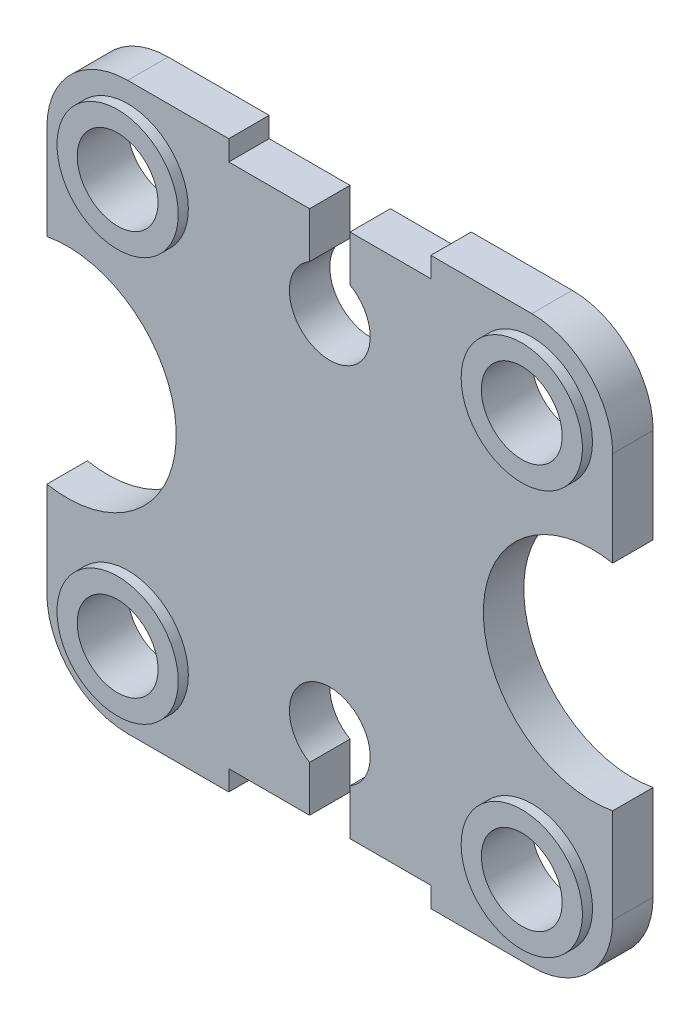
from build123d import *
from build123d.topology import SkipClean

# Parameters (mm, degrees)
SKETCH1_R                                    = 30
BOSS_EXTRUDE3_DEPTH                          = 20
SKETCH1_3_R                                  = 30
SKETCH1_3_R_2                                = 20
BOSS_EXTRUDE4_DEPTH                          = 25
MIRROR1_AT_THE_SECOND_PLANE_COPY_1_SKETC_R   = 30
MIRROR1_AT_THE_SECOND_PLANE_COPY_1_DEPTH     = 20
MIRROR1_AT_THE_SECOND_PLANE_COPY_2_SKETC_R   = 30
MIRROR1_AT_THE_SECOND_PLANE_COPY_2_SKETC_R_2 = 20
MIRROR1_AT_THE_SECOND_PLANE_COPY_2_DEPTH     = 25


with BuildPart() as part:
    # Sketch1 → Boss-Extrude3 (new body)
    with BuildSketch(Plane.XY):
        with BuildLine():
            Line((-140, 100), (-140, 53.065996646))
            ThreePointArc((-140, 53.065996646), (-95.532624121, 41.569219382), (-76, 0))
            Line((-76, 0), (0, 0))
            Line((0, 0), (0, 70))
            ThreePointArc((0, 70), (-19.318516526, 84.823619098), (-10, 107.320508076))
            Line((-10, 107.320508076), (-10, 130))
            Line((-10, 130), (-50, 130))
            Line((-50, 130), (-50, 140))
            Line((-50, 140), (-100, 140))
            ThreePointArc((-100, 140), (-128.284271247, 128.284271247), (-140, 100))
        make_face()
        with Locations((-100, 100)):
            Circle(SKETCH1_R, mode=Mode.SUBTRACT)
    boss_extrude3 = extrude(amount=BOSS_EXTRUDE3_DEPTH)

    # Sketch1<3> → Boss-Extrude4 (add)
    with BuildSketch(Plane.XY):
        with Locations((-100, 100)):
            Circle(SKETCH1_3_R)
        with Locations((-100, 100)):
            Circle(SKETCH1_3_R_2, mode=Mode.SUBTRACT)
    boss_extrude4 = extrude(amount=BOSS_EXTRUDE4_DEPTH)

    # Mirror1: Boss-Extrude3, Boss-Extrude4 across plane
    add(boss_extrude3.mirror(Plane(origin=(0, 0, 0), x_dir=(0, 0, 1), z_dir=(1, 0, 0))))
    add(boss_extrude4.mirror(Plane(origin=(0, 0, 0), x_dir=(0, 0, 1), z_dir=(1, 0, 0))))

    # Mirror1 at the second plane: Boss-Extrude3, Boss-Extrude4 across plane
    with SkipClean():  # the faces are left unmerged after this step: merging them gives an invalid solid
        add(boss_extrude3.mirror(Plane.ZX))
        add(boss_extrude4.mirror(Plane.ZX))

    # Mirror1 at the second plane copy 1 sketc → Mirror1 at the second plane copy 1 (add)
    with SkipClean():  # the faces are left unmerged after this step: merging them gives an invalid solid
        with BuildSketch(Plane(origin=(0, 0, 0), x_dir=(-1, 0, 0), z_dir=(0, 0, 1))):
            with BuildLine():
                Line((-140, 100), (-140, 53.065996646))
                ThreePointArc((-140, 53.065996646), (-95.532624121, 41.569219382), (-76, 0))
                Line((-76, 0), (0, 0))
                Line((0, 0), (0, 70))
                ThreePointArc((0, 70), (-19.318516526, 84.823619098), (-10, 107.320508076))
                Line((-10, 107.320508076), (-10, 130))
                Line((-10, 130), (-50, 130))
                Line((-50, 130), (-50, 140))
                Line((-50, 140), (-100, 140))
                ThreePointArc((-100, 140), (-128.284271247, 128.284271247), (-140, 100))
            make_face()
            with Locations((-100, 100)):
                Circle(MIRROR1_AT_THE_SECOND_PLANE_COPY_1_SKETC_R, mode=Mode.SUBTRACT)
        extrude(amount=MIRROR1_AT_THE_SECOND_PLANE_COPY_1_DEPTH)

    # Mirror1 at the second plane copy 2 sketc → Mirror1 at the second plane copy 2 (add)
    with SkipClean():  # the faces are left unmerged after this step: merging them gives an invalid solid
        with BuildSketch(Plane(origin=(0, 0, 0), x_dir=(-1, 0, 0), z_dir=(0, 0, 1))):
            with Locations((-100, 100)):
                Circle(MIRROR1_AT_THE_SECOND_PLANE_COPY_2_SKETC_R)
            with Locations((-100, 100)):
                Circle(MIRROR1_AT_THE_SECOND_PLANE_COPY_2_SKETC_R_2, mode=Mode.SUBTRACT)
        extrude(amount=MIRROR1_AT_THE_SECOND_PLANE_COPY_2_DEPTH)


solid = part.part
